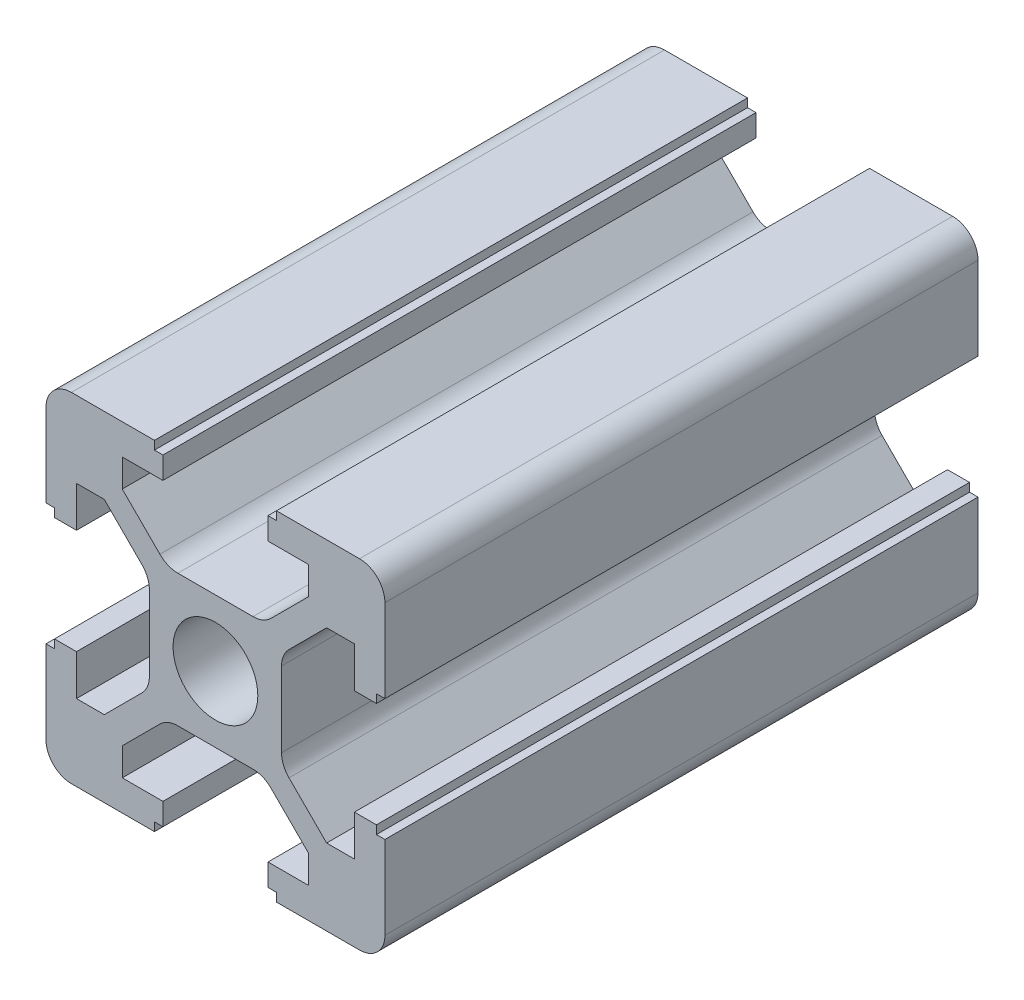
from build123d import *

# Parameters (mm, degrees)
SKETCH_1_R      = 2.5
EXTRUDE_1_DEPTH = 17.5


with BuildPart() as part:
    # 草图1 → 凸台-拉伸1 (new, symmetric)
    with BuildSketch(Plane.XY):
        with BuildLine():
            Line((-6.560660172, 5.5), (-4.339339828, 3.278679656))
            ThreePointArc((-4.339339828, 3.278679656), (-4.014180701, 2.792044633), (-3.9, 2.218019485))
            Line((-3.9, 2.218019485), (-3.9, -2.218019485))
            ThreePointArc((-3.9, -2.218019485), (-4.014180701, -2.792044633), (-4.339339828, -3.278679656))
            Line((-4.339339828, -3.278679656), (-6.560660172, -5.5))
            Line((-6.560660172, -5.5), (-8.2, -5.5))
            Line((-8.2, -5.5), (-8.2, -3.1))
            Line((-8.2, -3.1), (-9.5, -3.1))
            Line((-9.5, -3.1), (-9.5, -3.6))
            Line((-9.5, -3.6), (-10, -3.6))
            Line((-10, -3.6), (-10, -8.5))
            ThreePointArc((-10, -8.5), (-9.560660172, -9.560660172), (-8.5, -10))
            Line((-8.5, -10), (-3.6, -10))
            Line((-3.6, -10), (-3.6, -9.5))
            Line((-3.6, -9.5), (-3.1, -9.5))
            Line((-3.1, -9.5), (-3.1, -8.2))
            Line((-3.1, -8.2), (-5.5, -8.2))
            Line((-5.5, -8.2), (-5.5, -6.560660172))
            Line((-5.5, -6.560660172), (-3.278679656, -4.339339828))
            ThreePointArc((-3.278679656, -4.339339828), (-2.792044633, -4.014180701), (-2.218019485, -3.9))
            Line((-2.218019485, -3.9), (2.218019485, -3.9))
            ThreePointArc((2.218019485, -3.9), (2.792044633, -4.014180701), (3.278679656, -4.339339828))
            Line((3.278679656, -4.339339828), (5.5, -6.560660172))
            Line((5.5, -6.560660172), (5.5, -8.2))
            Line((5.5, -8.2), (3.1, -8.2))
            Line((3.1, -8.2), (3.1, -9.5))
            Line((3.1, -9.5), (3.6, -9.5))
            Line((3.6, -9.5), (3.6, -10))
            Line((3.6, -10), (8.5, -10))
            ThreePointArc((8.5, -10), (9.560660172, -9.560660172), (10, -8.5))
            Line((10, -8.5), (10, -3.6))
            Line((10, -3.6), (9.5, -3.6))
            Line((9.5, -3.6), (9.5, -3.1))
            Line((9.5, -3.1), (8.2, -3.1))
            Line((8.2, -3.1), (8.2, -5.5))
            Line((8.2, -5.5), (6.560660172, -5.5))
            Line((6.560660172, -5.5), (4.339339828, -3.278679656))
            ThreePointArc((4.339339828, -3.278679656), (4.014180701, -2.792044633), (3.9, -2.218019485))
            Line((3.9, -2.218019485), (3.9, 2.218019485))
            ThreePointArc((3.9, 2.218019485), (4.014180701, 2.792044633), (4.339339828, 3.278679656))
            Line((4.339339828, 3.278679656), (6.560660172, 5.5))
            Line((6.560660172, 5.5), (8.2, 5.5))
            Line((8.2, 5.5), (8.2, 3.1))
            Line((8.2, 3.1), (9.5, 3.1))
            Line((9.5, 3.1), (9.5, 3.6))
            Line((9.5, 3.6), (10, 3.6))
            Line((10, 3.6), (10, 8.5))
            ThreePointArc((10, 8.5), (9.560660172, 9.560660172), (8.5, 10))
            Line((8.5, 10), (3.6, 10))
            Line((3.6, 10), (3.6, 9.5))
            Line((3.6, 9.5), (3.1, 9.5))
            Line((3.1, 9.5), (3.1, 8.2))
            Line((3.1, 8.2), (5.5, 8.2))
            Line((5.5, 8.2), (5.5, 6.560660172))
            Line((5.5, 6.560660172), (3.278679656, 4.339339828))
            ThreePointArc((3.278679656, 4.339339828), (2.792044633, 4.014180701), (2.218019485, 3.9))
            Line((2.218019485, 3.9), (-2.218019485, 3.9))
            ThreePointArc((-2.218019485, 3.9), (-2.792044633, 4.014180701), (-3.278679656, 4.339339828))
            Line((-3.278679656, 4.339339828), (-5.5, 6.560660172))
            Line((-5.5, 6.560660172), (-5.5, 8.2))
            Line((-5.5, 8.2), (-3.1, 8.2))
            Line((-3.1, 8.2), (-3.1, 9.5))
            Line((-3.1, 9.5), (-3.6, 9.5))
            Line((-3.6, 9.5), (-3.6, 10))
            Line((-3.6, 10), (-8.5, 10))
            ThreePointArc((-8.5, 10), (-9.560660172, 9.560660172), (-10, 8.5))
            Line((-10, 8.5), (-10, 3.6))
            Line((-10, 3.6), (-9.5, 3.6))
            Line((-9.5, 3.6), (-9.5, 3.1))
            Line((-9.5, 3.1), (-8.2, 3.1))
            Line((-8.2, 3.1), (-8.2, 5.5))
            Line((-8.2, 5.5), (-6.560660172, 5.5))
        make_face()
        Circle(SKETCH_1_R, mode=Mode.SUBTRACT)
    extrude(amount=EXTRUDE_1_DEPTH, both=True)


solid = part.part
